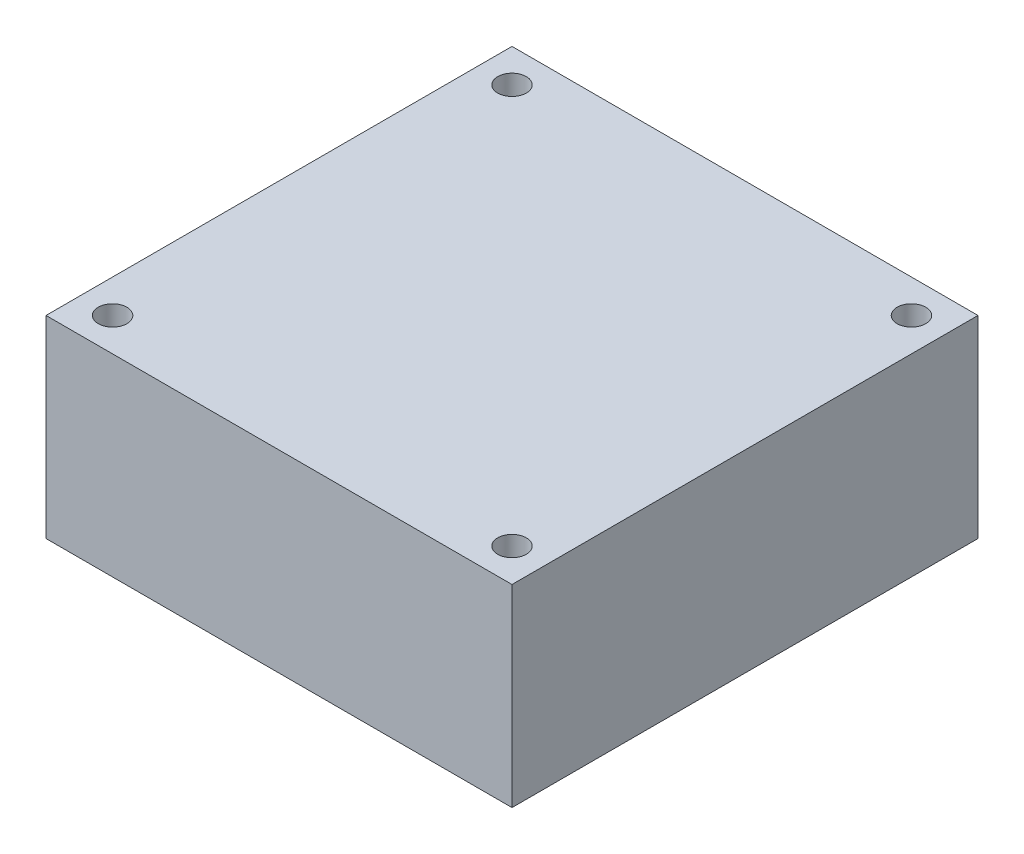
from build123d import *

# Parameters (mm, degrees)
SKETCH1_W           = 70
SKETCH1_H           = 70
SKETCH1_R           = 2.15
BOSS_EXTRUDE1_DEPTH = 29.025


with BuildPart() as part:
    # Sketch1 → Boss-Extrude1 (new body)
    with BuildSketch(Plane(origin=(0, 0, 0), x_dir=(1, 0, 0), z_dir=(0, 1, 0))):
        Rectangle(SKETCH1_W, SKETCH1_H)
        with Locations(Location((30, 30, 0), (0, 0, 90))):
            Circle(SKETCH1_R, mode=Mode.SUBTRACT)
        with Locations(Location((-30, 30, 0), (0, 0, 90))):
            Circle(SKETCH1_R, mode=Mode.SUBTRACT)
        with Locations(Location((-30, -30, 0), (0, 0, 90))):
            Circle(SKETCH1_R, mode=Mode.SUBTRACT)
        with Locations(Location((30, -30, 0), (0, 0, 90))):
            Circle(SKETCH1_R, mode=Mode.SUBTRACT)
    extrude(amount=BOSS_EXTRUDE1_DEPTH)


solid = part.part
